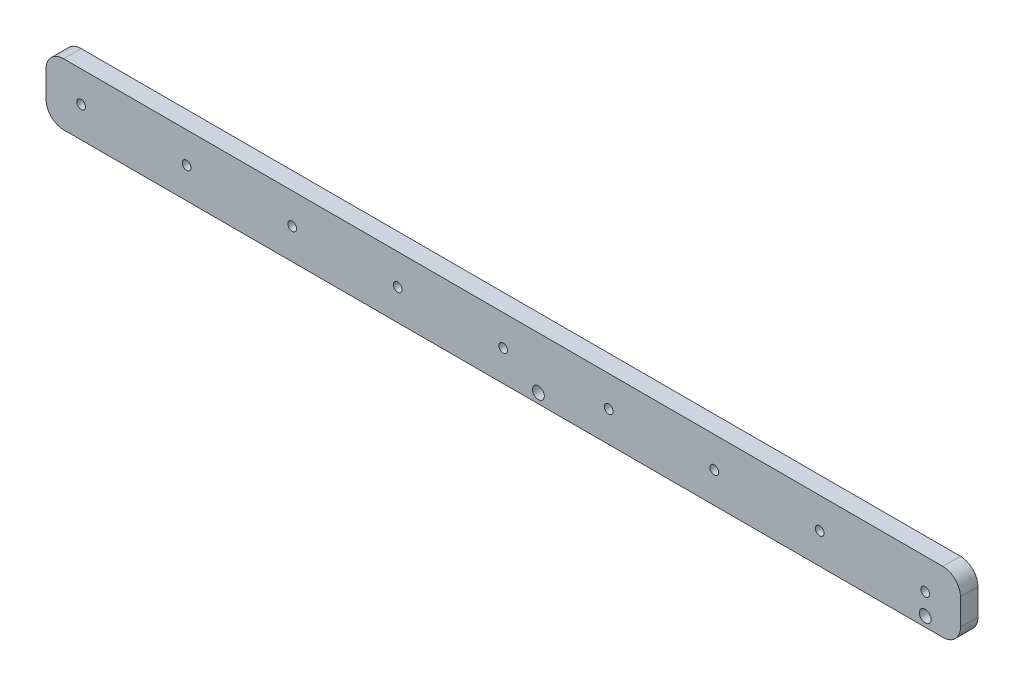
from build123d import *

# Parameters (mm, degrees)
ESQUISSE1_R             = 7
BOSS_EXTRU_1_DEPTH      = 10
BOSS_EXTRU_2_START      = -4
ESQUISSE2_R             = 7
ESQUISSE2_R_2           = 2.5
BOSS_EXTRU_2_DEPTH      = 4
ESQUISSE3_R             = 3.375
ENL_V_MAT_EXTRU_1_DEPTH = 261.780079761
ESQUISSE4_R             = 3.375
ENL_V_MAT_EXTRU_2_DEPTH = 261.780079761


with BuildPart() as part:
    # Esquisse1 → Boss.-Extru.1 (new body)
    with BuildSketch(Plane.XY):
        with BuildLine():
            Line((-250, 17.5), (250, 17.5))
            ThreePointArc((250, 17.5), (257.071067812, 14.571067812), (260, 7.5))
            Line((260, 7.5), (260, -7.5))
            ThreePointArc((260, -7.5), (257.071067812, -14.571067812), (250, -17.5))
            Line((250, -17.5), (-250, -17.5))
            ThreePointArc((-250, -17.5), (-257.071067812, -14.571067812), (-260, -7.5))
            Line((-260, -7.5), (-260, 7.5))
            ThreePointArc((-260, 7.5), (-257.071067812, 14.571067812), (-250, 17.5))
        make_face()
        with Locations((-240, 0)):
            Circle(ESQUISSE1_R, mode=Mode.SUBTRACT)
        with Locations((-180, 0)):
            Circle(ESQUISSE1_R, mode=Mode.SUBTRACT)
        with Locations((-120, 0)):
            Circle(ESQUISSE1_R, mode=Mode.SUBTRACT)
        with Locations((-60, 0)):
            Circle(ESQUISSE1_R, mode=Mode.SUBTRACT)
        Circle(ESQUISSE1_R, mode=Mode.SUBTRACT)
        with Locations((60, 0)):
            Circle(ESQUISSE1_R, mode=Mode.SUBTRACT)
        with Locations((120, 0)):
            Circle(ESQUISSE1_R, mode=Mode.SUBTRACT)
        with Locations((180, 0)):
            Circle(ESQUISSE1_R, mode=Mode.SUBTRACT)
        with Locations((240, 0)):
            Circle(ESQUISSE1_R, mode=Mode.SUBTRACT)
    extrude(amount=BOSS_EXTRU_1_DEPTH)

    # Esquisse2 → Boss.-Extru.2 (add)
    # profile 1 of 9: a face of its own
    with BuildSketch(Plane.XY.offset(10).offset(BOSS_EXTRU_2_START)):
        with Locations((-240, 0)):
            Circle(ESQUISSE2_R)
        with Locations((-240, 0)):
            Circle(ESQUISSE2_R_2, mode=Mode.SUBTRACT)
    # profile 2 of 9: a face of its own
    with BuildSketch(Plane.XY.offset(10).offset(BOSS_EXTRU_2_START)):
        with Locations((-180, 0)):
            Circle(ESQUISSE2_R)
        with Locations((-180, 0)):
            Circle(ESQUISSE2_R_2, mode=Mode.SUBTRACT)
    # profile 3 of 9: a face of its own
    with BuildSketch(Plane.XY.offset(10).offset(BOSS_EXTRU_2_START)):
        with Locations((-120, 0)):
            Circle(ESQUISSE2_R)
        with Locations((-120, 0)):
            Circle(ESQUISSE2_R_2, mode=Mode.SUBTRACT)
    # profile 4 of 9: a face of its own
    with BuildSketch(Plane.XY.offset(10).offset(BOSS_EXTRU_2_START)):
        with Locations((-60, 0)):
            Circle(ESQUISSE2_R)
        with Locations((-60, 0)):
            Circle(ESQUISSE2_R_2, mode=Mode.SUBTRACT)
    # profile 5 of 9: a face of its own
    with BuildSketch(Plane.XY.offset(10).offset(BOSS_EXTRU_2_START)):
        Circle(ESQUISSE2_R)
        Circle(ESQUISSE2_R_2, mode=Mode.SUBTRACT)
    # profile 6 of 9: a face of its own
    with BuildSketch(Plane.XY.offset(10).offset(BOSS_EXTRU_2_START)):
        with Locations((60, 0)):
            Circle(ESQUISSE2_R)
        with Locations((60, 0)):
            Circle(ESQUISSE2_R_2, mode=Mode.SUBTRACT)
    # profile 7 of 9: a face of its own
    with BuildSketch(Plane.XY.offset(10).offset(BOSS_EXTRU_2_START)):
        with Locations((120, 0)):
            Circle(ESQUISSE2_R)
        with Locations((120, 0)):
            Circle(ESQUISSE2_R_2, mode=Mode.SUBTRACT)
    # profile 8 of 9: a face of its own
    with BuildSketch(Plane.XY.offset(10).offset(BOSS_EXTRU_2_START)):
        with Locations((180, 0)):
            Circle(ESQUISSE2_R)
        with Locations((180, 0)):
            Circle(ESQUISSE2_R_2, mode=Mode.SUBTRACT)
    # profile 9 of 9: a face of its own
    with BuildSketch(Plane.XY.offset(10).offset(BOSS_EXTRU_2_START)):
        with Locations((240, 0)):
            Circle(ESQUISSE2_R)
        with Locations((240, 0)):
            Circle(ESQUISSE2_R_2, mode=Mode.SUBTRACT)
    extrude(amount=BOSS_EXTRU_2_DEPTH)

    # Esquisse3 → Enlèv. mat.-Extru.1 (cut, through all)
    with BuildSketch(Plane.XY.offset(10)):
        with Locations((20.000000156, -12.000000313)):
            Circle(ESQUISSE3_R)
    extrude(amount=-ENL_V_MAT_EXTRU_1_DEPTH, mode=Mode.SUBTRACT)

    # Esquisse4 → Enlèv. mat.-Extru.2 (cut, through all)
    with BuildSketch(Plane.XY.offset(10)):
        with Locations((240.000000156, -12.000000313)):
            Circle(ESQUISSE4_R)
    extrude(amount=-ENL_V_MAT_EXTRU_2_DEPTH, mode=Mode.SUBTRACT)


solid = part.part
